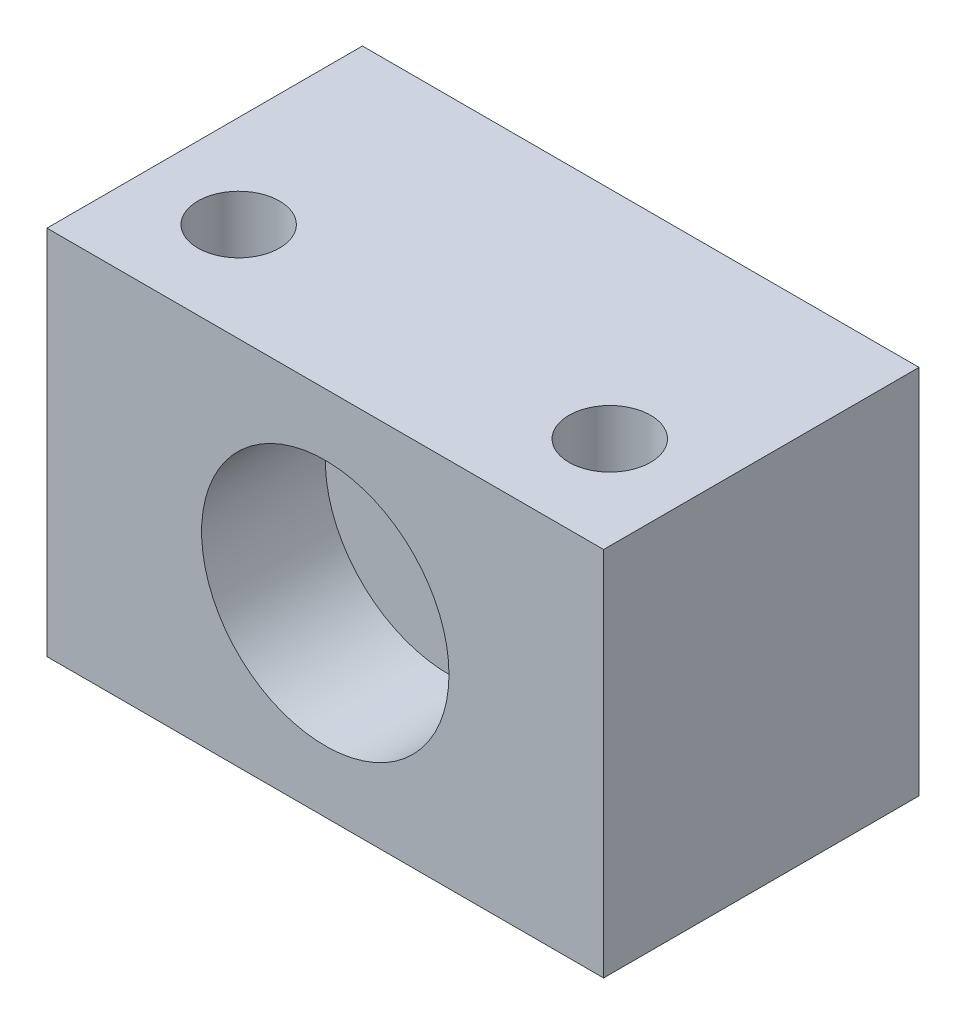
from build123d import *

# Parameters (mm, degrees)
SKETCH1_W           = 23
SKETCH1_H           = 12.75
SKETCH1_R           = 1.65
BOSS_EXTRUDE1_DEPTH = 15
SKETCH2_R           = 1.65
CUT_EXTRUDE1_DEPTH  = 31.274783236
SKETCH3_R           = 5
CUT_EXTRUDE2_DEPTH  = 5
SKETCH4_OUTSIDE_W   = 31.054
SKETCH4_OUTSIDE_H   = 20.804
SKETCH4_OUTSIDE_W_2 = 22.5
SKETCH4_OUTSIDE_H_2 = 12.75
CUT_EXTRUDE3_DEPTH  = 31.274783236


with BuildPart() as part:
    # Sketch1 → Boss-Extrude1 (new body)
    with BuildSketch(Plane(origin=(0, 0, 0), x_dir=(1, 0, 0), z_dir=(0, 1, 0))):
        with Locations((11.5, 6.375)):
            Rectangle(SKETCH1_W, SKETCH1_H)
        with Locations(Location((4, 4, 0), (0, 0, 270))):
            Circle(SKETCH1_R, mode=Mode.SUBTRACT)
        with Locations(Location((19, 4, 0), (0, 0, 270))):
            Circle(SKETCH1_R, mode=Mode.SUBTRACT)
    extrude(amount=BOSS_EXTRUDE1_DEPTH)

    # Sketch2 → Cut-Extrude1 (cut, through all)
    with BuildSketch(Plane.XY):
        with Locations((11.5, 7.5)):
            Circle(SKETCH2_R)
    extrude(amount=-CUT_EXTRUDE1_DEPTH, mode=Mode.SUBTRACT)

    # Sketch3 → Cut-Extrude2 (cut)
    with BuildSketch(Plane.XY):
        with Locations((11.5, 7.5)):
            Circle(SKETCH3_R)
    extrude(amount=-CUT_EXTRUDE2_DEPTH, mode=Mode.SUBTRACT)

    # Sketch4 outside → Cut-Extrude3 (cut, through all)
    with BuildSketch(Plane(origin=(0, 15, 0), x_dir=(1, 0, 0), z_dir=(0, 1, 0))):
        with Locations((11.5, 6.375)):
            Rectangle(SKETCH4_OUTSIDE_W, SKETCH4_OUTSIDE_H)
        with Locations((11.5, 6.375)):
            Rectangle(SKETCH4_OUTSIDE_W_2, SKETCH4_OUTSIDE_H_2, mode=Mode.SUBTRACT)
    extrude(amount=-CUT_EXTRUDE3_DEPTH, mode=Mode.SUBTRACT)


solid = part.part
